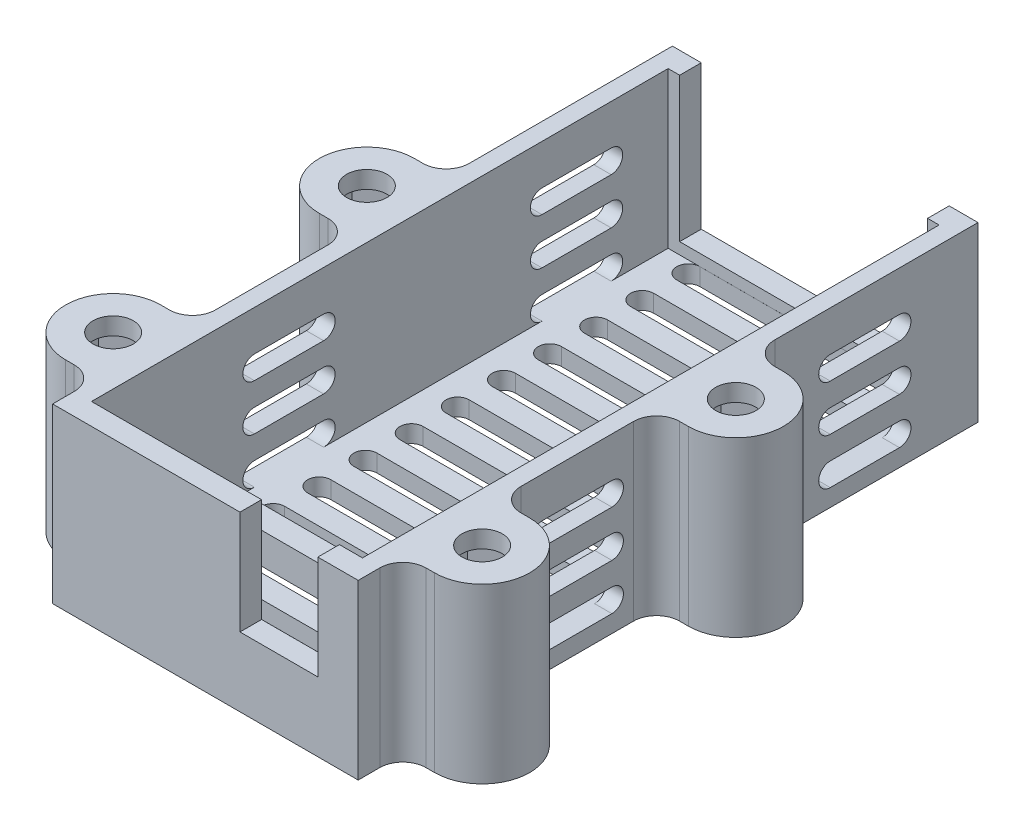
from build123d import *

# Parameters (mm, degrees)
SKETCH1_R           = 1.75
BOSS_EXTRUDE2_DEPTH = 1.5
SKETCH2_R           = 1.75
SKETCH2_W           = 23.5
SKETCH2_H           = 50.005253482
BOSS_EXTRUDE3_DEPTH = 13.5
SKETCH3_W           = 21.5
SKETCH3_H           = 1.872373259
CUT_EXTRUDE1_DEPTH  = 12.5
CUT_EXTRUDE2_REACH  = 61.322
SKETCH4_W           = 6.75
SKETCH4_H           = 9
CUT_EXTRUDE3_DEPTH  = 13.5
CUT_EXTRUDE4_REACH  = 38.773
SKETCH7_W           = 23.5
SKETCH7_H           = 2
BOSS_EXTRUDE4_DEPTH = 1.2
CUT_EXTRUDE5_REACH  = 47.4
FILLET1_R           = 2


with BuildPart() as part:
    # Sketch1 → Boss-Extrude2 (new body)
    with BuildSketch(Plane(origin=(0, 0, 0), x_dir=(1, 0, 0), z_dir=(0, 1, 0))):
        with BuildLine():
            Line((13.25, -26.875), (13.25, -23))
            Line((13.25, -23), (16, -23))
            ThreePointArc((16, -23), (20.125, -18.875), (16, -14.75))
            Line((16, -14.75), (13.25, -14.75))
            Line((13.25, -14.75), (13.25, -1))
            Line((13.25, -1), (16, -1))
            ThreePointArc((16, -1), (20.125, 3.125), (16, 7.25))
            Line((16, 7.25), (13.25, 7.25))
            Line((13.25, 7.25), (13.25, 26.875))
            Line((13.25, 26.875), (-13.25, 26.875))
            Line((-13.25, 26.875), (-13.25, 7.25))
            Line((-13.25, 7.25), (-16, 7.25))
            ThreePointArc((-16, 7.25), (-20.125, 3.125), (-16, -1))
            Line((-16, -1), (-13.25, -1))
            Line((-13.25, -1), (-13.25, -14.75))
            Line((-13.25, -14.75), (-16, -14.75))
            ThreePointArc((-16, -14.75), (-20.125, -18.875), (-16, -23))
            Line((-16, -23), (-13.25, -23))
            Line((-13.25, -23), (-13.25, -26.875))
            Line((-13.25, -26.875), (13.25, -26.875))
        make_face()
        with Locations(Location((16, -18.875, 0), (0, 0, 270))):
            Circle(SKETCH1_R, mode=Mode.SUBTRACT)
        with Locations(Location((-16, 3.125, 0), (0, 0, 270))):
            Circle(SKETCH1_R, mode=Mode.SUBTRACT)
        with Locations(Location((16, 3.125, 0), (0, 0, 270))):
            Circle(SKETCH1_R, mode=Mode.SUBTRACT)
        with Locations(Location((-16, -18.875, 0), (0, 0, 270))):
            Circle(SKETCH1_R, mode=Mode.SUBTRACT)
    extrude(amount=BOSS_EXTRUDE2_DEPTH)

    # Sketch2 → Boss-Extrude3 (add)
    with BuildSketch(Plane(origin=(0, 1.5, 0), x_dir=(1, 0, 0), z_dir=(0, 1, 0))):
        with BuildLine():
            Line((13.25, 26.875), (-13.25, 26.875))
            Line((-13.25, 26.875), (-13.25, 7.25))
            Line((-13.25, 7.25), (-16, 7.25))
            ThreePointArc((-16, 7.25), (-20.125, 3.125), (-16, -1))
            Line((-16, -1), (-13.25, -1))
            Line((-13.25, -1), (-13.25, -14.75))
            Line((-13.25, -14.75), (-16, -14.75))
            ThreePointArc((-16, -14.75), (-20.125, -18.875), (-16, -23))
            Line((-16, -23), (-13.25, -23))
            Line((-13.25, -23), (-13.25, -26.875))
            Line((-13.25, -26.875), (13.25, -26.875))
            Line((13.25, -26.875), (13.25, -23))
            Line((13.25, -23), (16, -23))
            ThreePointArc((16, -23), (20.125, -18.875), (16, -14.75))
            Line((16, -14.75), (13.25, -14.75))
            Line((13.25, -14.75), (13.25, -1))
            Line((13.25, -1), (16, -1))
            ThreePointArc((16, -1), (20.125, 3.125), (16, 7.25))
            Line((16, 7.25), (13.25, 7.25))
            Line((13.25, 7.25), (13.25, 26.875))
        make_face()
        with Locations(Location((-16, 3.125, 0), (0, 0, 270))):
            Circle(SKETCH2_R, mode=Mode.SUBTRACT)
        with Locations(Location((-16, -18.875, 0), (0, 0, 270))):
            Circle(SKETCH2_R, mode=Mode.SUBTRACT)
        with Locations(Location((16, -18.875, 0), (0, 0, 270))):
            Circle(SKETCH2_R, mode=Mode.SUBTRACT)
        with Locations(Location((16, 3.125, 0), (0, 0, 270))):
            Circle(SKETCH2_R, mode=Mode.SUBTRACT)
        Rectangle(SKETCH2_W, SKETCH2_H, mode=Mode.SUBTRACT)
    extrude(amount=BOSS_EXTRUDE3_DEPTH)

    # Sketch3 → Cut-Extrude1 (cut)
    with BuildSketch(Plane(origin=(0, 15, 0), x_dir=(1, 0, 0), z_dir=(0, 1, 0))):
        with Locations((0, 25.938813371)):
            Rectangle(SKETCH3_W, SKETCH3_H)
    extrude(amount=-CUT_EXTRUDE1_DEPTH, mode=Mode.SUBTRACT)

    # Sketch4 → Cut-Extrude2 (cut, up to next)
    with BuildSketch(Plane.XY.offset(26.875), mode=Mode.PRIVATE) as cut_extrude2_sk1:
        with Locations((6.375, 10.5)):
            Rectangle(SKETCH4_W, SKETCH4_H)
    cut_extrude2_tool1 = extrude(cut_extrude2_sk1.sketch, amount=-CUT_EXTRUDE2_REACH, mode=Mode.PRIVATE) & part.part
    add(cut_extrude2_tool1.solids().sort_by_distance((6.375, 10.5, 26.875))[0], mode=Mode.SUBTRACT)

    # Sketch5 → Cut-Extrude3 (cut)
    with BuildSketch(Plane.XZ):
        Polygon((-16, 15.410898385), (-13, 17.142949192), (-13, 20.607050808), (-16, 22.339101615), (-19, 20.607050808), (-19, 17.142949192), align=None)
        Polygon((16, 15.410898385), (19, 17.142949192), (19, 20.607050808), (16, 22.339101615), (13, 20.607050808), (13, 17.142949192), align=None)
        Polygon((16, -6.589101615), (19, -4.857050808), (19, -1.392949192), (16, 0.339101615), (13, -1.392949192), (13, -4.857050808), align=None)
        Polygon((-16, -6.589101615), (-13, -4.857050808), (-13, -1.392949192), (-16, 0.339101615), (-19, -1.392949192), (-19, -4.857050808), align=None)
    extrude(amount=-CUT_EXTRUDE3_DEPTH, mode=Mode.SUBTRACT)

    # Sketch6 → Cut-Extrude4 (cut, up to next)
    with BuildSketch(Plane.XZ, mode=Mode.PRIVATE) as cut_extrude4_sk1:
        with BuildLine():
            Line((-9, 1), (9, 1))
            ThreePointArc((9, 1), (10, 0), (9, -1))
            Line((9, -1), (-9, -1))
            ThreePointArc((-9, -1), (-10, 0), (-9, 1))
        make_face()
    cut_extrude4_tool1 = extrude(cut_extrude4_sk1.sketch, amount=-CUT_EXTRUDE4_REACH, mode=Mode.PRIVATE) & part.part
    # Sketch6 → Cut-Extrude4 (cut, up to next)
    with BuildSketch(Plane.XZ, mode=Mode.PRIVATE) as cut_extrude4_sk2:
        with BuildLine():
            Line((-9, 5), (9, 5))
            ThreePointArc((9, 5), (10, 4), (9, 3))
            Line((9, 3), (-9, 3))
            ThreePointArc((-9, 3), (-10, 4), (-9, 5))
        make_face()
    cut_extrude4_tool2 = extrude(cut_extrude4_sk2.sketch, amount=-CUT_EXTRUDE4_REACH, mode=Mode.PRIVATE) & part.part
    # Sketch6 → Cut-Extrude4 (cut, up to next)
    with BuildSketch(Plane.XZ, mode=Mode.PRIVATE) as cut_extrude4_sk3:
        with BuildLine():
            Line((-9, 9), (9, 9))
            ThreePointArc((9, 9), (10, 8), (9, 7))
            Line((9, 7), (-9, 7))
            ThreePointArc((-9, 7), (-10, 8), (-9, 9))
        make_face()
    cut_extrude4_tool3 = extrude(cut_extrude4_sk3.sketch, amount=-CUT_EXTRUDE4_REACH, mode=Mode.PRIVATE) & part.part
    # Sketch6 → Cut-Extrude4 (cut, up to next)
    with BuildSketch(Plane.XZ, mode=Mode.PRIVATE) as cut_extrude4_sk4:
        with BuildLine():
            Line((-9, 13), (9, 13))
            ThreePointArc((9, 13), (10, 12), (9, 11))
            Line((9, 11), (-9, 11))
            ThreePointArc((-9, 11), (-10, 12), (-9, 13))
        make_face()
    cut_extrude4_tool4 = extrude(cut_extrude4_sk4.sketch, amount=-CUT_EXTRUDE4_REACH, mode=Mode.PRIVATE) & part.part
    # Sketch6 → Cut-Extrude4 (cut, up to next)
    with BuildSketch(Plane.XZ, mode=Mode.PRIVATE) as cut_extrude4_sk5:
        with BuildLine():
            Line((-9, 17), (9, 17))
            ThreePointArc((9, 17), (10, 16), (9, 15))
            Line((9, 15), (-9, 15))
            ThreePointArc((-9, 15), (-10, 16), (-9, 17))
        make_face()
    cut_extrude4_tool5 = extrude(cut_extrude4_sk5.sketch, amount=-CUT_EXTRUDE4_REACH, mode=Mode.PRIVATE) & part.part
    # Sketch6 → Cut-Extrude4 (cut, up to next)
    with BuildSketch(Plane.XZ, mode=Mode.PRIVATE) as cut_extrude4_sk6:
        with BuildLine():
            Line((-9, 21), (9, 21))
            ThreePointArc((9, 21), (10, 20), (9, 19))
            Line((9, 19), (-9, 19))
            ThreePointArc((-9, 19), (-10, 20), (-9, 21))
        make_face()
    cut_extrude4_tool6 = extrude(cut_extrude4_sk6.sketch, amount=-CUT_EXTRUDE4_REACH, mode=Mode.PRIVATE) & part.part
    # Sketch6 → Cut-Extrude4 (cut, up to next)
    with BuildSketch(Plane.XZ, mode=Mode.PRIVATE) as cut_extrude4_sk7:
        with BuildLine():
            Line((-9, 25), (9, 25))
            ThreePointArc((9, 25), (10, 24), (9, 23))
            Line((9, 23), (-9, 23))
            ThreePointArc((-9, 23), (-10, 24), (-9, 25))
        make_face()
    cut_extrude4_tool7 = extrude(cut_extrude4_sk7.sketch, amount=-CUT_EXTRUDE4_REACH, mode=Mode.PRIVATE) & part.part
    # Sketch6 → Cut-Extrude4 (cut, up to next)
    with BuildSketch(Plane.XZ, mode=Mode.PRIVATE) as cut_extrude4_sk8:
        with BuildLine():
            Line((-9, -5), (9, -5))
            ThreePointArc((9, -5), (10, -4), (9, -3))
            Line((9, -3), (-9, -3))
            ThreePointArc((-9, -3), (-10, -4), (-9, -5))
        make_face()
    cut_extrude4_tool8 = extrude(cut_extrude4_sk8.sketch, amount=-CUT_EXTRUDE4_REACH, mode=Mode.PRIVATE) & part.part
    # Sketch6 → Cut-Extrude4 (cut, up to next)
    with BuildSketch(Plane.XZ, mode=Mode.PRIVATE) as cut_extrude4_sk9:
        with BuildLine():
            Line((-9, -9), (9, -9))
            ThreePointArc((9, -9), (10, -8), (9, -7))
            Line((9, -7), (-9, -7))
            ThreePointArc((-9, -7), (-10, -8), (-9, -9))
        make_face()
    cut_extrude4_tool9 = extrude(cut_extrude4_sk9.sketch, amount=-CUT_EXTRUDE4_REACH, mode=Mode.PRIVATE) & part.part
    # Sketch6 → Cut-Extrude4 (cut, up to next)
    with BuildSketch(Plane.XZ, mode=Mode.PRIVATE) as cut_extrude4_sk10:
        with BuildLine():
            Line((-9, -13), (9, -13))
            ThreePointArc((9, -13), (10, -12), (9, -11))
            Line((9, -11), (-9, -11))
            ThreePointArc((-9, -11), (-10, -12), (-9, -13))
        make_face()
    cut_extrude4_tool10 = extrude(cut_extrude4_sk10.sketch, amount=-CUT_EXTRUDE4_REACH, mode=Mode.PRIVATE) & part.part
    # Sketch6 → Cut-Extrude4 (cut, up to next)
    with BuildSketch(Plane.XZ, mode=Mode.PRIVATE) as cut_extrude4_sk11:
        with BuildLine():
            Line((-9, -17), (9, -17))
            ThreePointArc((9, -17), (10, -16), (9, -15))
            Line((9, -15), (-9, -15))
            ThreePointArc((-9, -15), (-10, -16), (-9, -17))
        make_face()
    cut_extrude4_tool11 = extrude(cut_extrude4_sk11.sketch, amount=-CUT_EXTRUDE4_REACH, mode=Mode.PRIVATE) & part.part
    # Sketch6 → Cut-Extrude4 (cut, up to next)
    with BuildSketch(Plane.XZ, mode=Mode.PRIVATE) as cut_extrude4_sk12:
        with BuildLine():
            Line((-9, -21), (9, -21))
            ThreePointArc((9, -21), (10, -20), (9, -19))
            Line((9, -19), (-9, -19))
            ThreePointArc((-9, -19), (-10, -20), (-9, -21))
        make_face()
    cut_extrude4_tool12 = extrude(cut_extrude4_sk12.sketch, amount=-CUT_EXTRUDE4_REACH, mode=Mode.PRIVATE) & part.part
    # Sketch6 → Cut-Extrude4 (cut, up to next)
    with BuildSketch(Plane.XZ, mode=Mode.PRIVATE) as cut_extrude4_sk13:
        with BuildLine():
            Line((-9, -25), (9, -25))
            ThreePointArc((9, -25), (10, -24), (9, -23))
            Line((9, -23), (-9, -23))
            ThreePointArc((-9, -23), (-10, -24), (-9, -25))
        make_face()
    cut_extrude4_tool13 = extrude(cut_extrude4_sk13.sketch, amount=-CUT_EXTRUDE4_REACH, mode=Mode.PRIVATE) & part.part
    add(cut_extrude4_tool1.solids().sort_by_distance((0, 0, 0))[0], mode=Mode.SUBTRACT)
    add(cut_extrude4_tool2.solids().sort_by_distance((0, 0, 4))[0], mode=Mode.SUBTRACT)
    add(cut_extrude4_tool3.solids().sort_by_distance((0, 0, 8))[0], mode=Mode.SUBTRACT)
    add(cut_extrude4_tool4.solids().sort_by_distance((0, 0, 12))[0], mode=Mode.SUBTRACT)
    add(cut_extrude4_tool5.solids().sort_by_distance((0, 0, 16))[0], mode=Mode.SUBTRACT)
    add(cut_extrude4_tool6.solids().sort_by_distance((0, 0, 20))[0], mode=Mode.SUBTRACT)
    add(cut_extrude4_tool7.solids().sort_by_distance((0, 0, 24))[0], mode=Mode.SUBTRACT)
    add(cut_extrude4_tool8.solids().sort_by_distance((0, 0, -4))[0], mode=Mode.SUBTRACT)
    add(cut_extrude4_tool9.solids().sort_by_distance((0, 0, -8))[0], mode=Mode.SUBTRACT)
    add(cut_extrude4_tool10.solids().sort_by_distance((0, 0, -12))[0], mode=Mode.SUBTRACT)
    add(cut_extrude4_tool11.solids().sort_by_distance((0, 0, -16))[0], mode=Mode.SUBTRACT)
    add(cut_extrude4_tool12.solids().sort_by_distance((0, 0, -20))[0], mode=Mode.SUBTRACT)
    add(cut_extrude4_tool13.solids().sort_by_distance((0, 0, -24))[0], mode=Mode.SUBTRACT)

    # Sketch7 → Boss-Extrude4 (add)
    with BuildSketch(Plane(origin=(0, 1.5, 0), x_dir=(1, 0, 0), z_dir=(0, 1, 0))):
        with Locations((0, -14)):
            Rectangle(SKETCH7_W, SKETCH7_H)
    extrude(amount=BOSS_EXTRUDE4_DEPTH)

    # Cut-Extrude5: up to this face of the body (flat: up to its plane)
    cut_extrude5_end = Plane(part.part.faces().sort_by_distance((-13.25, 7.5, -17.0625))[0])
    # Sketch8 → Cut-Extrude5 (cut, up to the picked face)
    with BuildSketch(Plane(origin=(13.25, 0, 0), x_dir=(0, 0, -1), z_dir=(1, 0, 0)), mode=Mode.PRIVATE) as cut_extrude5_sk1:
        with BuildLine():
            Line((-10.875, 3.5), (-4.875, 3.5))
            ThreePointArc((-4.875, 3.5), (-3.875, 2.5), (-4.875, 1.5))
            Line((-4.875, 1.5), (-10.875, 1.5))
            ThreePointArc((-10.875, 1.5), (-11.875, 2.5), (-10.875, 3.5))
        make_face()
    cut_extrude5_tool1 = split(extrude(cut_extrude5_sk1.sketch, amount=-CUT_EXTRUDE5_REACH, mode=Mode.PRIVATE), bisect_by=cut_extrude5_end, keep=Keep.BOTH, mode=Mode.PRIVATE)
    # Sketch8 → Cut-Extrude5 (cut, up to the picked face)
    with BuildSketch(Plane(origin=(13.25, 0, 0), x_dir=(0, 0, -1), z_dir=(1, 0, 0)), mode=Mode.PRIVATE) as cut_extrude5_sk2:
        with BuildLine():
            Line((14.0625, 3.5), (20.0625, 3.5))
            ThreePointArc((20.0625, 3.5), (21.0625, 2.5), (20.0625, 1.5))
            Line((20.0625, 1.5), (14.0625, 1.5))
            ThreePointArc((14.0625, 1.5), (13.0625, 2.5), (14.0625, 3.5))
        make_face()
    cut_extrude5_tool2 = split(extrude(cut_extrude5_sk2.sketch, amount=-CUT_EXTRUDE5_REACH, mode=Mode.PRIVATE), bisect_by=cut_extrude5_end, keep=Keep.BOTH, mode=Mode.PRIVATE)
    # Sketch8 → Cut-Extrude5 (cut, up to the picked face)
    with BuildSketch(Plane(origin=(13.25, 0, 0), x_dir=(0, 0, -1), z_dir=(1, 0, 0)), mode=Mode.PRIVATE) as cut_extrude5_sk3:
        with BuildLine():
            Line((-10.875, 7.5), (-4.875, 7.5))
            ThreePointArc((-4.875, 7.5), (-3.875, 6.5), (-4.875, 5.5))
            Line((-4.875, 5.5), (-10.875, 5.5))
            ThreePointArc((-10.875, 5.5), (-11.875, 6.5), (-10.875, 7.5))
        make_face()
    cut_extrude5_tool3 = split(extrude(cut_extrude5_sk3.sketch, amount=-CUT_EXTRUDE5_REACH, mode=Mode.PRIVATE), bisect_by=cut_extrude5_end, keep=Keep.BOTH, mode=Mode.PRIVATE)
    # Sketch8 → Cut-Extrude5 (cut, up to the picked face)
    with BuildSketch(Plane(origin=(13.25, 0, 0), x_dir=(0, 0, -1), z_dir=(1, 0, 0)), mode=Mode.PRIVATE) as cut_extrude5_sk4:
        with BuildLine():
            Line((14.0625, 7.5), (20.0625, 7.5))
            ThreePointArc((20.0625, 7.5), (21.0625, 6.5), (20.0625, 5.5))
            Line((20.0625, 5.5), (14.0625, 5.5))
            ThreePointArc((14.0625, 5.5), (13.0625, 6.5), (14.0625, 7.5))
        make_face()
    cut_extrude5_tool4 = split(extrude(cut_extrude5_sk4.sketch, amount=-CUT_EXTRUDE5_REACH, mode=Mode.PRIVATE), bisect_by=cut_extrude5_end, keep=Keep.BOTH, mode=Mode.PRIVATE)
    # Sketch8 → Cut-Extrude5 (cut, up to the picked face)
    with BuildSketch(Plane(origin=(13.25, 0, 0), x_dir=(0, 0, -1), z_dir=(1, 0, 0)), mode=Mode.PRIVATE) as cut_extrude5_sk5:
        with BuildLine():
            Line((-10.875, 11.5), (-4.875, 11.5))
            ThreePointArc((-4.875, 11.5), (-3.875, 10.5), (-4.875, 9.5))
            Line((-4.875, 9.5), (-10.875, 9.5))
            ThreePointArc((-10.875, 9.5), (-11.875, 10.5), (-10.875, 11.5))
        make_face()
    cut_extrude5_tool5 = split(extrude(cut_extrude5_sk5.sketch, amount=-CUT_EXTRUDE5_REACH, mode=Mode.PRIVATE), bisect_by=cut_extrude5_end, keep=Keep.BOTH, mode=Mode.PRIVATE)
    # Sketch8 → Cut-Extrude5 (cut, up to the picked face)
    with BuildSketch(Plane(origin=(13.25, 0, 0), x_dir=(0, 0, -1), z_dir=(1, 0, 0)), mode=Mode.PRIVATE) as cut_extrude5_sk6:
        with BuildLine():
            Line((14.0625, 11.5), (20.0625, 11.5))
            ThreePointArc((20.0625, 11.5), (21.0625, 10.5), (20.0625, 9.5))
            Line((20.0625, 9.5), (14.0625, 9.5))
            ThreePointArc((14.0625, 9.5), (13.0625, 10.5), (14.0625, 11.5))
        make_face()
    cut_extrude5_tool6 = split(extrude(cut_extrude5_sk6.sketch, amount=-CUT_EXTRUDE5_REACH, mode=Mode.PRIVATE), bisect_by=cut_extrude5_end, keep=Keep.BOTH, mode=Mode.PRIVATE)
    add(cut_extrude5_tool1.solids().sort_by(Axis((13.25, 2.5, 7.875), (-1, 0, 0)))[0], mode=Mode.SUBTRACT)
    add(cut_extrude5_tool2.solids().sort_by(Axis((13.25, 2.5, -17.0625), (-1, 0, 0)))[0], mode=Mode.SUBTRACT)
    add(cut_extrude5_tool3.solids().sort_by(Axis((13.25, 6.5, 7.875), (-1, 0, 0)))[0], mode=Mode.SUBTRACT)
    add(cut_extrude5_tool4.solids().sort_by(Axis((13.25, 6.5, -17.0625), (-1, 0, 0)))[0], mode=Mode.SUBTRACT)
    add(cut_extrude5_tool5.solids().sort_by(Axis((13.25, 10.5, 7.875), (-1, 0, 0)))[0], mode=Mode.SUBTRACT)
    add(cut_extrude5_tool6.solids().sort_by(Axis((13.25, 10.5, -17.0625), (-1, 0, 0)))[0], mode=Mode.SUBTRACT)

    # Fillet1
    fillet1_edges = [part.edges().sort_by_distance(p)[0] for p in [
        (13.25, 7.5, 23),
        (-13.25, 7.5, 23),
        (-13.25, 7.5, 14.75),
        (-13.25, 7.5, 1),
        (-13.25, 7.5, -7.25),
        (13.25, 7.5, -7.25),
        (13.25, 7.5, 1),
        (13.25, 7.5, 14.75),
    ]]
    fillet(fillet1_edges, radius=FILLET1_R)


solid = part.part
